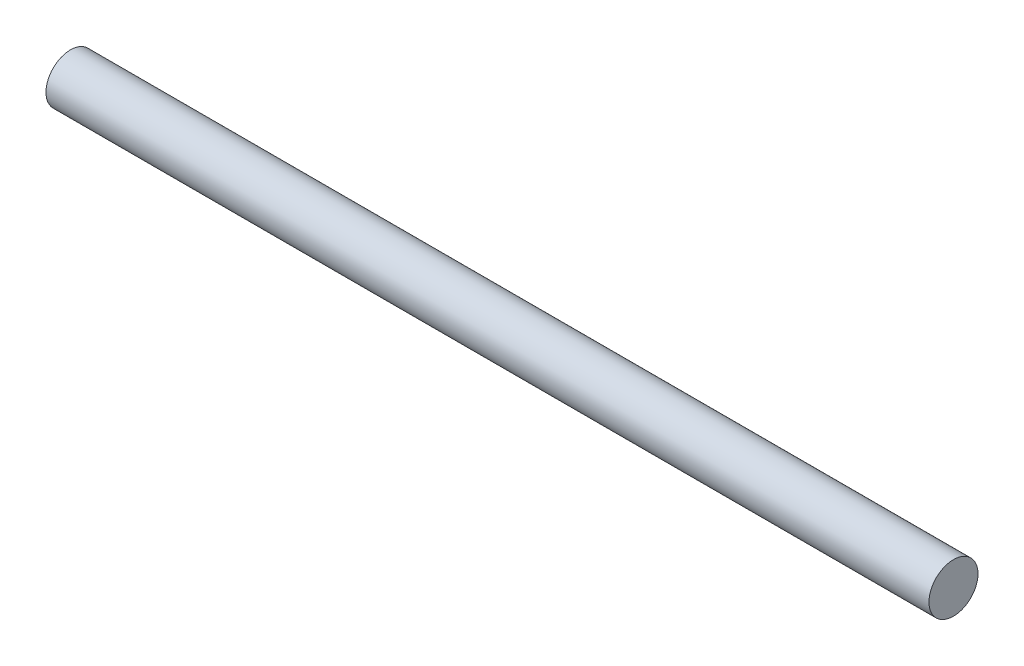
from build123d import *

# Parameters (mm, degrees)
SKETCH1_R           = 7.5
BOSS_EXTRUDE1_DEPTH = 270


with BuildPart() as part:
    # Sketch1 → Boss-Extrude1 (new body)
    with BuildSketch(Plane(origin=(0, 0, 0), x_dir=(0, 0, -1), z_dir=(1, 0, 0))):
        Circle(SKETCH1_R)
    extrude(amount=BOSS_EXTRUDE1_DEPTH)


solid = part.part
